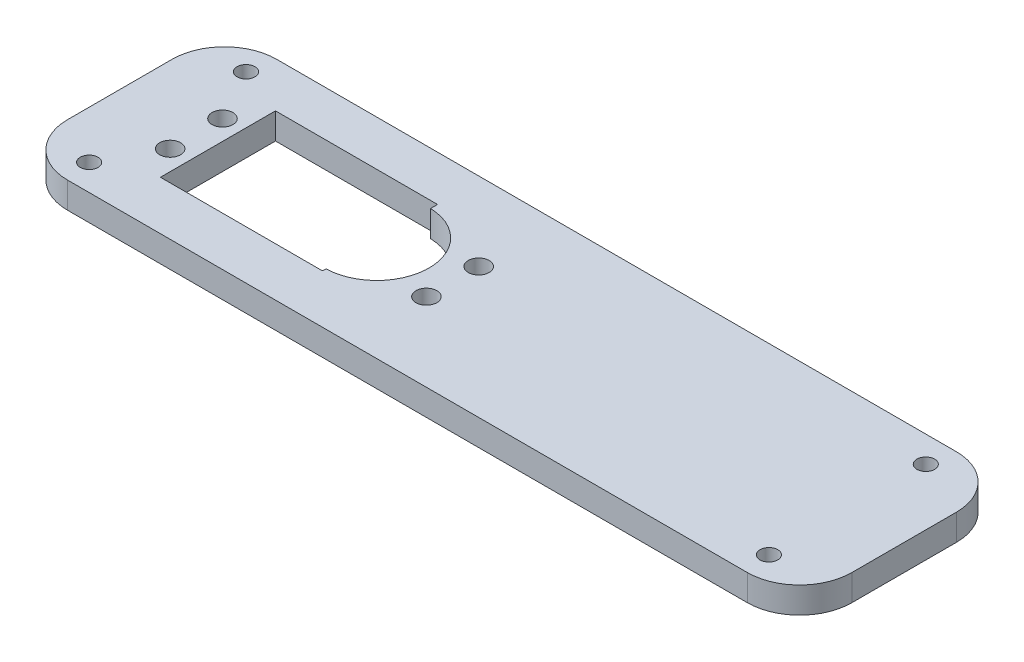
from build123d import *

# Parameters (mm, degrees)
SKETCH9_W           = 150
SKETCH9_H           = 40
BOSS_EXTRUDE5_DEPTH = 5
SKETCH10_R          = 10
SKETCH10_R_2        = 8
SKETCH10_R_3        = 2
CUT_EXTRUDE5_DEPTH  = 103.952823134
SKETCH11_R          = 1.7
CUT_EXTRUDE6_DEPTH  = 103.952823134
FILLET1_R           = 10


with BuildPart() as part:
    # Sketch9 → Boss-Extrude5 (new body)
    with BuildSketch(Plane(origin=(0, 0, 0), x_dir=(1, 0, 0), z_dir=(0, 1, 0))):
        with Locations((25.867654831, 0)):
            Rectangle(SKETCH9_W, SKETCH9_H)
    extrude(amount=BOSS_EXTRUDE5_DEPTH)

    # Sketch10 → Cut-Extrude5 (cut, through all)
    # profile 1 of 12: a face of its own
    with BuildSketch(Plane(origin=(0, 5, 0), x_dir=(1, 0, 0), z_dir=(0, 1, 0))):
        Circle(SKETCH10_R)
    # profile 2 of 12: a face of its own
    with BuildSketch(Plane(origin=(0, 5, 0), x_dir=(1, 0, 0), z_dir=(0, 1, 0))):
        Polygon((0.292318991, -10.661038996), (0.292318991, 11.338961004), (-30.707681009, 11.345685511), (-30.711010445, -10.656347446), align=None)
        with Locations((-13, 0)):
            Circle(SKETCH10_R_2, mode=Mode.SUBTRACT)
    # profile 3 of 12: a face of its own
    with BuildSketch(Plane(origin=(0, 5, 0), x_dir=(1, 0, 0), z_dir=(0, 1, 0))):
        with BuildLine():
            ThreePointArc((10, 0), (7.173673742, 6.966950914), (0.292318991, 9.995726567))
            Line((0.292318991, 9.995726567), (0.292318991, -9.995726567))
            ThreePointArc((0.292318991, -9.995726567), (7.173673742, -6.966950914), (10, 0))
        make_face()
    # profile 4 of 12: a face of its own
    with BuildSketch(Plane(origin=(0, 5, 0), x_dir=(1, 0, 0), z_dir=(0, 1, 0))):
        with BuildLine():
            Line((0.292318991, -9.995726567), (0.292318991, 9.995726567))
            ThreePointArc((0.292318991, 9.995726567), (-4.255176628, 9.049501194), (-7.884615385, 6.150840612))
            ThreePointArc((-7.884615385, 6.150840612), (-5.756966211, 3.396831102), (-5, 0))
            ThreePointArc((-5, 0), (-5.756966211, -3.396831102), (-7.884615385, -6.150840612))
            ThreePointArc((-7.884615385, -6.150840612), (-4.255176628, -9.049501194), (0.292318991, -9.995726567))
        make_face()
    # profile 5 of 12: a face of its own
    with BuildSketch(Plane(origin=(0, 5, 0), x_dir=(1, 0, 0), z_dir=(0, 1, 0))):
        Circle(SKETCH10_R)
    # profile 6 of 12: a face of its own
    with BuildSketch(Plane(origin=(0, 5, 0), x_dir=(1, 0, 0), z_dir=(0, 1, 0))):
        with Locations((-13, 0)):
            Circle(SKETCH10_R_2)
    # profile 7 of 12: a face of its own
    with BuildSketch(Plane(origin=(0, 5, 0), x_dir=(1, 0, 0), z_dir=(0, 1, 0))):
        Circle(SKETCH10_R)
    # profile 8 of 12: a face of its own
    with BuildSketch(Plane(origin=(0, 5, 0), x_dir=(1, 0, 0), z_dir=(0, 1, 0))):
        with Locations((-13, 0)):
            Circle(SKETCH10_R_2)
    # profile 9 of 12: a face of its own
    with BuildSketch(Plane(origin=(0, 5, 0), x_dir=(1, 0, 0), z_dir=(0, 1, 0))):
        with Locations(Location((14.5, 5, 0), (0, 0, 270))):
            Circle(SKETCH10_R_3)
    # profile 10 of 12: a face of its own
    with BuildSketch(Plane(origin=(0, 5, 0), x_dir=(1, 0, 0), z_dir=(0, 1, 0))):
        with Locations(Location((14.5, -5, 0), (0, 0, 270))):
            Circle(SKETCH10_R_3)
    # profile 11 of 12: a face of its own
    with BuildSketch(Plane(origin=(0, 5, 0), x_dir=(1, 0, 0), z_dir=(0, 1, 0))):
        with Locations(Location((-34.5, 5, 0), (0, 0, 270))):
            Circle(SKETCH10_R_3)
    # profile 12 of 12: a face of its own
    with BuildSketch(Plane(origin=(0, 5, 0), x_dir=(1, 0, 0), z_dir=(0, 1, 0))):
        with Locations(Location((-34.5, -5, 0), (0, 0, 270))):
            Circle(SKETCH10_R_3)
    extrude(amount=-CUT_EXTRUDE5_DEPTH, mode=Mode.SUBTRACT)

    # Sketch11 → Cut-Extrude6 (cut, through all)
    with BuildSketch(Plane(origin=(0, 5, 0), x_dir=(1, 0, 0), z_dir=(0, 1, 0))):
        with Locations(Location((-40, 15, 0), (0, 0, 270))):
            Circle(SKETCH11_R)
        with Locations(Location((90, 15, 0), (0, 0, 270))):
            Circle(SKETCH11_R)
        with Locations(Location((90, -15, 0), (0, 0, 270))):
            Circle(SKETCH11_R)
        with Locations(Location((-40, -15, 0), (0, 0, 270))):
            Circle(SKETCH11_R)
    extrude(amount=-CUT_EXTRUDE6_DEPTH, mode=Mode.SUBTRACT)

    # Fillet1
    fillet1_edges = [part.edges().sort_by_distance(p)[0] for p in [
        (100.867654831, 2.5, 20),
        (-49.132345169, 2.5, 20),
        (-49.132345169, 2.5, -20),
        (100.867654831, 2.5, -20),
    ]]
    fillet(fillet1_edges, radius=FILLET1_R)


solid = part.part
